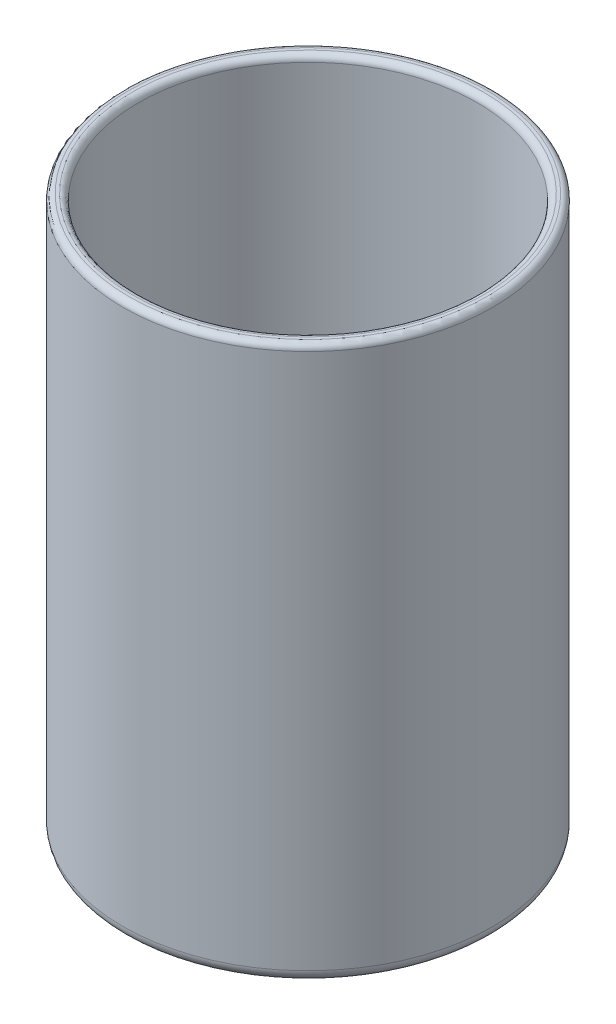
from build123d import *

# Parameters (mm, degrees)
SKETCH1_R           = 38.1
BOSS_EXTRUDE1_DEPTH = 5.08
SKETCH3_R           = 38.1
SKETCH3_R_2         = 34.925
BOSS_EXTRUDE2_DEPTH = 109.22
FILLET1_R           = 1.27
FILLET2_R           = 2.54


with BuildPart() as part:
    # Sketch1 → Boss-Extrude1 (new body)
    with BuildSketch(Plane(origin=(0, 0, 0), x_dir=(1, 0, 0), z_dir=(0, 1, 0))):
        with Locations(Location((0, 0, 0), (0, 0, 270))):
            Circle(SKETCH1_R)
    extrude(amount=BOSS_EXTRUDE1_DEPTH)

    # Sketch3 → Boss-Extrude2 (add)
    with BuildSketch(Plane(origin=(0, 5.08, 0), x_dir=(1, 0, 0), z_dir=(0, 1, 0))):
        with Locations(Location((0, 0, 0), (0, 0, 270))):
            Circle(SKETCH3_R)
        with Locations(Location((0, 0, 0), (0, 0, 270))):
            Circle(SKETCH3_R_2, mode=Mode.SUBTRACT)
    extrude(amount=BOSS_EXTRUDE2_DEPTH)

    # Fillet1
    fillet1_edges = [part.edges().sort_by_distance(p)[0] for p in [
        (0, 114.3, -38.1),
        (0, 114.3, -34.925),
    ]]
    fillet(fillet1_edges, radius=FILLET1_R)

    # Fillet2
    fillet2_edges = [part.edges().sort_by_distance(p)[0] for p in [
        (0, 0, -38.1),
    ]]
    fillet(fillet2_edges, radius=FILLET2_R)


solid = part.part
